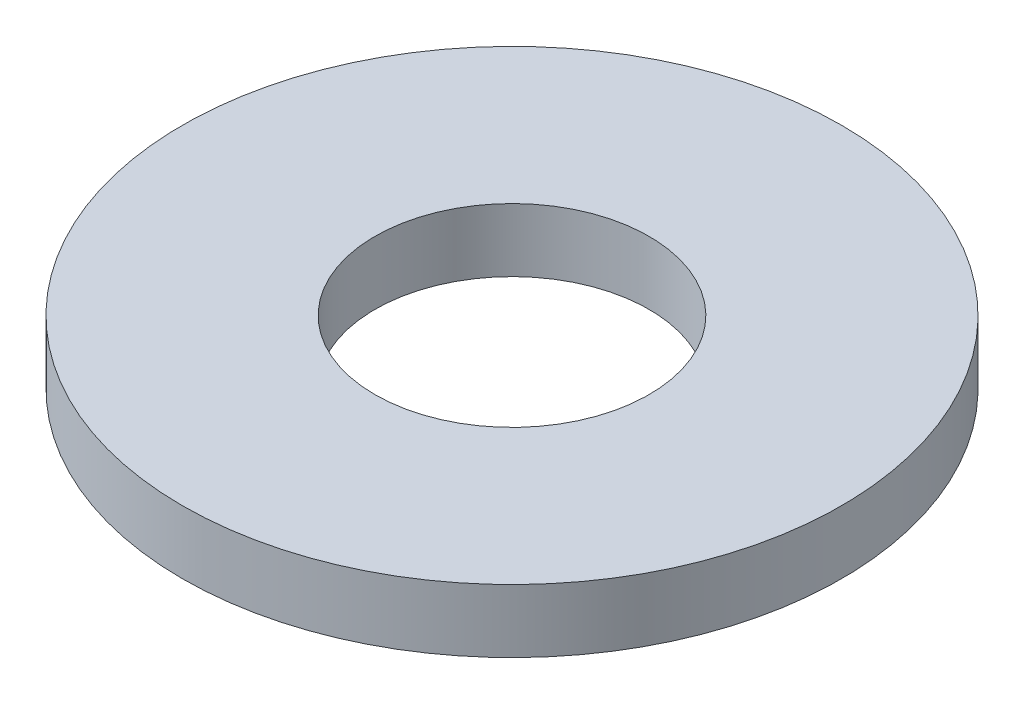
from build123d import *

# Parameters (mm, degrees)
SKETCH1_R           = 9.525
BOSS_EXTRUDE1_DEPTH = 1.8288
SKETCH5_R           = 3.9624
CUT_EXTRUDE1_DEPTH  = 14.593960403


with BuildPart() as part:
    # Sketch1 → Boss-Extrude1 (new body)
    with BuildSketch(Plane(origin=(0, 0, 0), x_dir=(1, 0, 0), z_dir=(0, 1, 0))):
        with Locations(Location((0, 0, 0), (0, 0, 270))):
            Circle(SKETCH1_R)
    extrude(amount=BOSS_EXTRUDE1_DEPTH)

    # Sketch5 → Cut-Extrude1 (cut, through all)
    with BuildSketch(Plane(origin=(0, 1.8288, 0), x_dir=(-1, 0, 0), z_dir=(0, 1, 0))):
        with Locations(Location((0, 0, 0), (0, 0, 90))):
            Circle(SKETCH5_R)
    extrude(amount=-CUT_EXTRUDE1_DEPTH, mode=Mode.SUBTRACT)


solid = part.part
